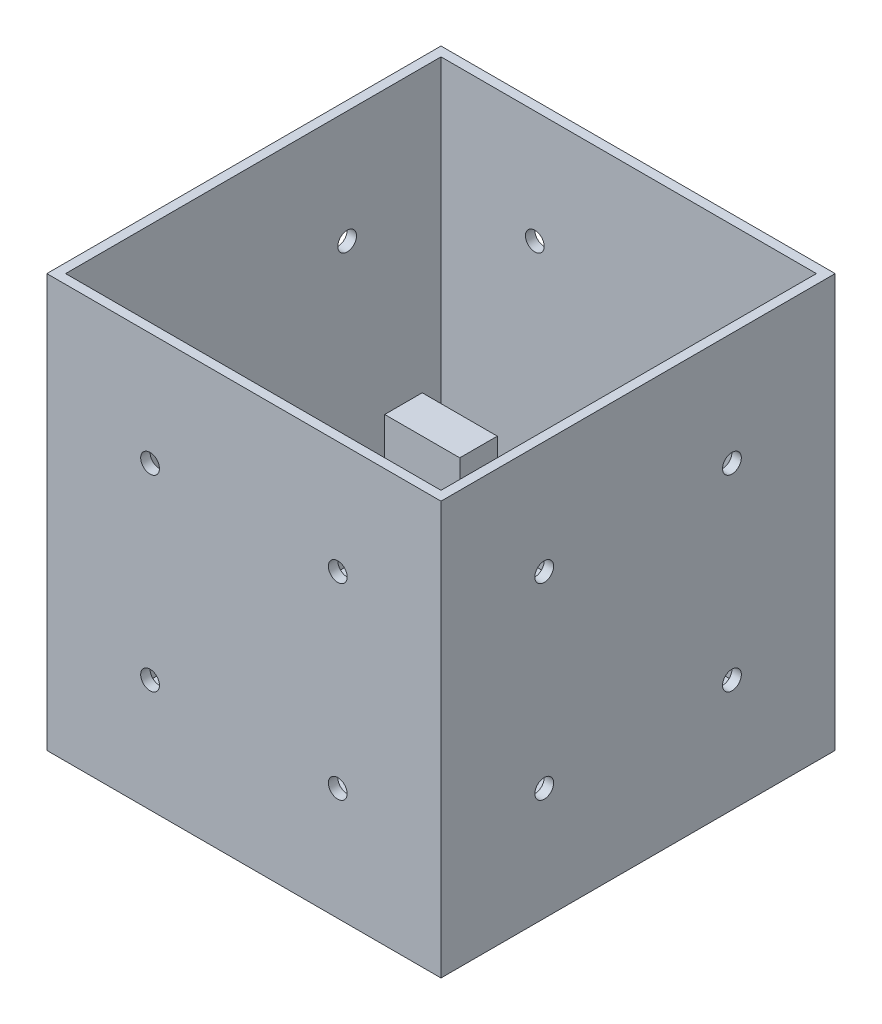
from build123d import *

# Parameters (mm, degrees)
SKETCH2_W           = 105
SKETCH2_H           = 105
BOSS_EXTRUDE2_DEPTH = 110
SKETCH3_W           = 100
SKETCH3_H           = 100
CUT_EXTRUDE1_DEPTH  = 105
SKETCH4_R           = 2.5
CUT_EXTRUDE2_DEPTH  = 5
SKETCH5_R           = 2.5
CUT_EXTRUDE3_DEPTH  = 5
SKETCH6_R           = 2.5
CUT_EXTRUDE4_DEPTH  = 5
SKETCH7_R           = 2.5
CUT_EXTRUDE5_DEPTH  = 5
SKETCH8_R           = 2.5
CUT_EXTRUDE12_DEPTH = 5
SKETCH13_R          = 2.5
CUT_EXTRUDE13_DEPTH = 5
SKETCH14_R          = 2.5
CUT_EXTRUDE14_DEPTH = 5
SKETCH15_R          = 2.5
CUT_EXTRUDE15_DEPTH = 5
SKETCH16_R          = 2.5
CUT_EXTRUDE16_DEPTH = 5
SKETCH17_R          = 2.5
CUT_EXTRUDE17_DEPTH = 5
SKETCH18_R          = 2.5
CUT_EXTRUDE18_DEPTH = 5
SKETCH19_R          = 2.5
CUT_EXTRUDE19_DEPTH = 5
CUT_EXTRUDE20_START = -5
SKETCH20_R          = 2.5
CUT_EXTRUDE20_DEPTH = 5
CUT_EXTRUDE21_START = -5
SKETCH21_R          = 2.5
CUT_EXTRUDE21_DEPTH = 5
CUT_EXTRUDE22_START = -5
SKETCH22_R          = 2.5
CUT_EXTRUDE22_DEPTH = 5
CUT_EXTRUDE23_START = -5
SKETCH23_R          = 2.5
CUT_EXTRUDE23_DEPTH = 5
CUT_EXTRUDE24_START = -5
SKETCH24_R          = 2.5
CUT_EXTRUDE24_DEPTH = 5
CUT_EXTRUDE25_START = -5
SKETCH25_R          = 2.5
CUT_EXTRUDE25_DEPTH = 5
CUT_EXTRUDE26_START = -5
SKETCH26_R          = 2.5
CUT_EXTRUDE26_DEPTH = 5
CUT_EXTRUDE27_START = -5
SKETCH27_R          = 2.5
CUT_EXTRUDE27_DEPTH = 5
SKETCH28_W          = 20
SKETCH28_H          = 10
BOSS_EXTRUDE3_DEPTH = 70


with BuildPart() as part:
    # Sketch2 → Boss-Extrude2 (new body)
    with BuildSketch(Plane(origin=(0, 0, 0), x_dir=(1, 0, 0), z_dir=(0, 1, 0))):
        Rectangle(SKETCH2_W, SKETCH2_H)
    extrude(amount=BOSS_EXTRUDE2_DEPTH)

    # Sketch3 → Cut-Extrude1 (cut)
    with BuildSketch(Plane(origin=(0, 110, 0), x_dir=(1, 0, 0), z_dir=(0, 1, 0))):
        Rectangle(SKETCH3_W, SKETCH3_H)
    extrude(amount=-CUT_EXTRUDE1_DEPTH, mode=Mode.SUBTRACT)

    # Sketch4 → Cut-Extrude2 (cut)
    with BuildSketch(Plane(origin=(0, 5, 0), x_dir=(1, 0, 0), z_dir=(0, 1, 0))):
        with Locations(Location((-25, 25, 0), (0, 0, 270))):
            Circle(SKETCH4_R)
    extrude(amount=-CUT_EXTRUDE2_DEPTH, mode=Mode.SUBTRACT)

    # Sketch5 → Cut-Extrude3 (cut)
    with BuildSketch(Plane.XZ):
        with Locations(Location((25, -25, 0), (0, 0, 270))):
            Circle(SKETCH5_R)
    extrude(amount=-CUT_EXTRUDE3_DEPTH, mode=Mode.SUBTRACT)

    # Sketch6 → Cut-Extrude4 (cut)
    with BuildSketch(Plane.XZ):
        with Locations(Location((25, 25, 0), (0, 0, 270))):
            Circle(SKETCH6_R)
    extrude(amount=-CUT_EXTRUDE4_DEPTH, mode=Mode.SUBTRACT)

    # Sketch7 → Cut-Extrude5 (cut)
    with BuildSketch(Plane.XZ):
        with Locations(Location((-25, 25, 0), (0, 0, 270))):
            Circle(SKETCH7_R)
    extrude(amount=-CUT_EXTRUDE5_DEPTH, mode=Mode.SUBTRACT)

    # Sketch8 → Cut-Extrude12 (cut)
    with BuildSketch(Plane.ZY.offset(52.5)):
        with Locations((-25, 80)):
            Circle(SKETCH8_R)
    extrude(amount=-CUT_EXTRUDE12_DEPTH, mode=Mode.SUBTRACT)

    # Sketch13 → Cut-Extrude13 (cut)
    with BuildSketch(Plane.ZY.offset(52.5)):
        with Locations((-25, 30)):
            Circle(SKETCH13_R)
    extrude(amount=-CUT_EXTRUDE13_DEPTH, mode=Mode.SUBTRACT)

    # Sketch14 → Cut-Extrude14 (cut)
    with BuildSketch(Plane.ZY.offset(52.5)):
        with Locations((25, 80)):
            Circle(SKETCH14_R)
    extrude(amount=-CUT_EXTRUDE14_DEPTH, mode=Mode.SUBTRACT)

    # Sketch15 → Cut-Extrude15 (cut)
    with BuildSketch(Plane.ZY.offset(52.5)):
        with Locations((25, 30)):
            Circle(SKETCH15_R)
    extrude(amount=-CUT_EXTRUDE15_DEPTH, mode=Mode.SUBTRACT)

    # Sketch16 → Cut-Extrude16 (cut)
    with BuildSketch(Plane(origin=(0, 0, -52.5), x_dir=(-1, 0, 0), z_dir=(0, 0, -1))):
        with Locations((25, 80)):
            Circle(SKETCH16_R)
    extrude(amount=-CUT_EXTRUDE16_DEPTH, mode=Mode.SUBTRACT)

    # Sketch17 → Cut-Extrude17 (cut)
    with BuildSketch(Plane(origin=(0, 0, -52.5), x_dir=(-1, 0, 0), z_dir=(0, 0, -1))):
        with Locations((25, 30)):
            Circle(SKETCH17_R)
    extrude(amount=-CUT_EXTRUDE17_DEPTH, mode=Mode.SUBTRACT)

    # Sketch18 → Cut-Extrude18 (cut)
    with BuildSketch(Plane(origin=(0, 0, -52.5), x_dir=(-1, 0, 0), z_dir=(0, 0, -1))):
        with Locations((-25, 80)):
            Circle(SKETCH18_R)
    extrude(amount=-CUT_EXTRUDE18_DEPTH, mode=Mode.SUBTRACT)

    # Sketch19 → Cut-Extrude19 (cut)
    with BuildSketch(Plane(origin=(0, 0, -52.5), x_dir=(-1, 0, 0), z_dir=(0, 0, -1))):
        with Locations((-25, 30)):
            Circle(SKETCH19_R)
    extrude(amount=-CUT_EXTRUDE19_DEPTH, mode=Mode.SUBTRACT)

    # Sketch20 → Cut-Extrude20 (cut)
    with BuildSketch(Plane(origin=(52.5, 0, 0), x_dir=(0, 0, -1), z_dir=(1, 0, 0)).offset(CUT_EXTRUDE20_START)):
        with Locations(Location((25, 80, 0), (0, 0, 180))):
            Circle(SKETCH20_R)
    extrude(amount=CUT_EXTRUDE20_DEPTH, mode=Mode.SUBTRACT)

    # Sketch21 → Cut-Extrude21 (cut)
    with BuildSketch(Plane(origin=(52.5, 0, 0), x_dir=(0, 0, -1), z_dir=(1, 0, 0)).offset(CUT_EXTRUDE21_START)):
        with Locations(Location((-25, 80, 0), (0, 0, 180))):
            Circle(SKETCH21_R)
    extrude(amount=CUT_EXTRUDE21_DEPTH, mode=Mode.SUBTRACT)

    # Sketch22 → Cut-Extrude22 (cut)
    with BuildSketch(Plane(origin=(52.5, 0, 0), x_dir=(0, 0, -1), z_dir=(1, 0, 0)).offset(CUT_EXTRUDE22_START)):
        with Locations(Location((25, 30, 0), (0, 0, 180))):
            Circle(SKETCH22_R)
    extrude(amount=CUT_EXTRUDE22_DEPTH, mode=Mode.SUBTRACT)

    # Sketch23 → Cut-Extrude23 (cut)
    with BuildSketch(Plane(origin=(52.5, 0, 0), x_dir=(0, 0, -1), z_dir=(1, 0, 0)).offset(CUT_EXTRUDE23_START)):
        with Locations(Location((-25, 30, 0), (0, 0, 180))):
            Circle(SKETCH23_R)
    extrude(amount=CUT_EXTRUDE23_DEPTH, mode=Mode.SUBTRACT)

    # Sketch24 → Cut-Extrude24 (cut)
    with BuildSketch(Plane.XY.offset(52.5).offset(CUT_EXTRUDE24_START)):
        with Locations(Location((-25, 80, 0), (0, 0, 180))):
            Circle(SKETCH24_R)
    extrude(amount=CUT_EXTRUDE24_DEPTH, mode=Mode.SUBTRACT)

    # Sketch25 → Cut-Extrude25 (cut)
    with BuildSketch(Plane.XY.offset(52.5).offset(CUT_EXTRUDE25_START)):
        with Locations(Location((25, 80, 0), (0, 0, 180))):
            Circle(SKETCH25_R)
    extrude(amount=CUT_EXTRUDE25_DEPTH, mode=Mode.SUBTRACT)

    # Sketch26 → Cut-Extrude26 (cut)
    with BuildSketch(Plane.XY.offset(52.5).offset(CUT_EXTRUDE26_START)):
        with Locations(Location((-25, 30, 0), (0, 0, 180))):
            Circle(SKETCH26_R)
    extrude(amount=CUT_EXTRUDE26_DEPTH, mode=Mode.SUBTRACT)

    # Sketch27 → Cut-Extrude27 (cut)
    with BuildSketch(Plane.XY.offset(52.5).offset(CUT_EXTRUDE27_START)):
        with Locations(Location((25, 30, 0), (0, 0, 180))):
            Circle(SKETCH27_R)
    extrude(amount=CUT_EXTRUDE27_DEPTH, mode=Mode.SUBTRACT)

    # Sketch28 → Boss-Extrude3 (add)
    with BuildSketch(Plane(origin=(0, 5, 0), x_dir=(1, 0, 0), z_dir=(0, 1, 0))):
        Rectangle(SKETCH28_W, SKETCH28_H)
    extrude(amount=BOSS_EXTRUDE3_DEPTH)


solid = part.part
